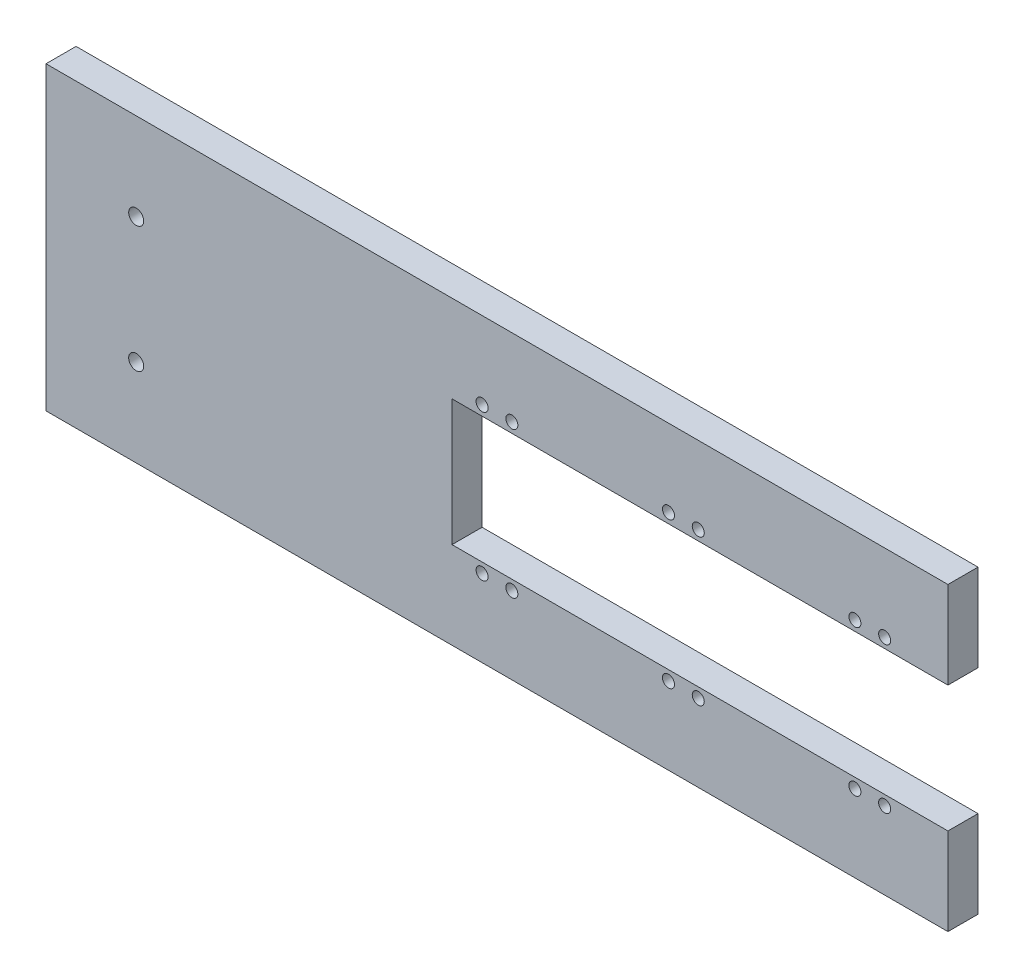
from build123d import *

# Parameters (mm, degrees)
SKETCH7_W           = 300
SKETCH7_H           = 100
BOSS_EXTRUDE1_DEPTH = 10
SKETCH1_R           = 2
CUT_EXTRUDE2_DEPTH  = 159.429795178
LPATTERN1_COUNT     = 4
LPATTERN1_PITCH     = 62
SKETCH8_W           = 164.95
SKETCH8_H           = 42
CUT_EXTRUDE3_DEPTH  = 159.429795178
SKETCH10_R          = 2.5
CUT_EXTRUDE4_DEPTH  = 159.429795178


with BuildPart() as part:
    # Sketch7 → Boss-Extrude1 (new body)
    with BuildSketch(Plane.XY):
        Rectangle(SKETCH7_W, SKETCH7_H)
    extrude(amount=-BOSS_EXTRUDE1_DEPTH)

    # Sketch1 → Cut-Extrude2 (cut, through all)
    with BuildSketch(Plane.XY):
        with Locations((4.95, -24.3)):
            Circle(SKETCH1_R)
        with Locations(Location((-4.95, -24.3, 0), (0, 0, 180))):
            Circle(SKETCH1_R)
        with Locations((-4.95, 24.3)):
            Circle(SKETCH1_R)
        with Locations(Location((4.95, 24.3, 0), (0, 0, 180))):
            Circle(SKETCH1_R)
    cut_extrude2 = extrude(amount=-CUT_EXTRUDE2_DEPTH, mode=Mode.SUBTRACT)

    # LPattern1: Cut-Extrude2 ×4
    with Locations(*[(i * LPATTERN1_PITCH, 0, 0) for i in range(1, LPATTERN1_COUNT)]):
        add(cut_extrude2, mode=Mode.SUBTRACT)

    # Sketch8 → Cut-Extrude3 (cut, through all)
    with BuildSketch(Plane.XY):
        with Locations((67.525, 0)):
            Rectangle(SKETCH8_W, SKETCH8_H)
    extrude(amount=-CUT_EXTRUDE3_DEPTH, mode=Mode.SUBTRACT)

    # Sketch10 → Cut-Extrude4 (cut, through all)
    with BuildSketch(Plane.XY):
        with Locations((-120, 20.93113616)):
            Circle(SKETCH10_R)
        with Locations(Location((-120, -20.93113616, 0), (0, 0, 180))):
            Circle(SKETCH10_R)
    extrude(amount=-CUT_EXTRUDE4_DEPTH, mode=Mode.SUBTRACT)


solid = part.part
